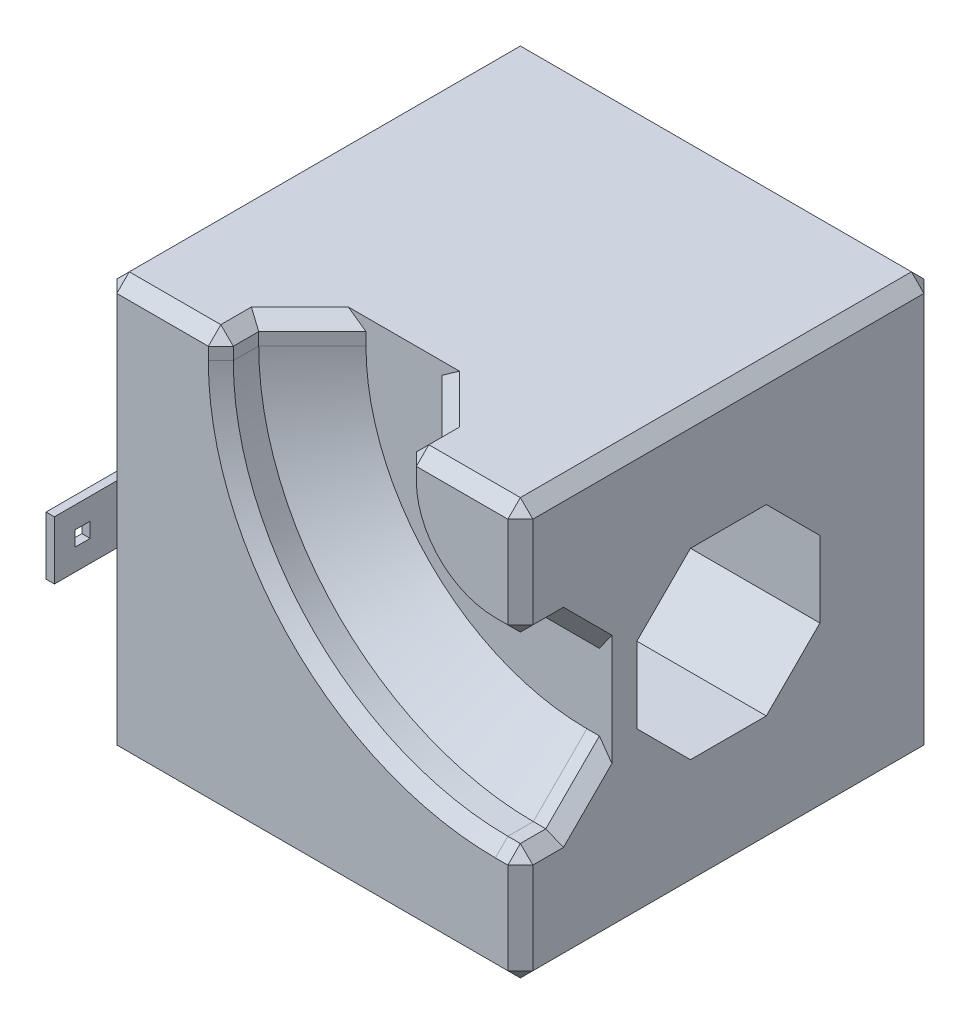
from build123d import *

# Parameters (mm, degrees)
SKETCH1_W                = 50
SKETCH1_H                = 50
BOSS_EXTRUDE1_DEPTH      = 50
CUT_EXTRUDE1_DEPTH       = 87.602540378
CHAMFER1_SIZE            = 1.5
BOSS_EXTRUDE2_DEPTH      = 7
BOSS_EXTRUDE2_DEPTH_BACK = 10
SKETCH5_W                = 1
SKETCH5_H                = 7
SKETCH6_W                = 1.8
SKETCH6_H                = 1.8
CUT_EXTRUDE2_DEPTH       = 7


with BuildPart() as part:
    # Sketch1 → Boss-Extrude1 (new body)
    with BuildSketch(Plane.XY):
        with Locations((25, 25)):
            Rectangle(SKETCH1_W, SKETCH1_H)
    extrude(amount=BOSS_EXTRUDE1_DEPTH)

    # Sketch2 → Cut-Extrude1 (cut, through all)
    with BuildSketch(Plane.ZY):
        Polygon((36, 29.556349186), (29.556349186, 36), (20.443650814, 36), (14, 29.556349186), (14, 20.443650814), (20.443650814, 14), (29.556349186, 14), (36, 20.443650814), align=None)
    extrude(amount=-CUT_EXTRUDE1_DEPTH, mode=Mode.SUBTRACT)

    # Cut-Sweep2: sweep along a path in Sketch4
    with BuildLine(Plane.XY.offset(50)) as cut_sweep2_path:
        Line((25, 50), (25, 47))
        ThreePointArc((25, 47), (31.443650814, 31.443650814), (47, 25))
        Line((47, 25), (50, 25))
    # Sketch3 → Cut-Sweep2 (sweep, cut)
    with BuildSketch(Plane.XZ.offset(-50)):
        Polygon((29.556349186, 39), (36, 45.443650814), (36, 54.556349186), (29.556349186, 61), (20.443650814, 61), (14, 54.556349186), (14, 45.443650814), (20.443650814, 39), align=None)
    sweep(path=cut_sweep2_path.line, mode=Mode.SUBTRACT)

    # Chamfer1
    chamfer1_edges = [part.edges().sort_by_distance(p)[0] for p in [
        (50, 7, 50),
        (43, 50, 50),
        (50, 43, 50),
        (7, 50, 50),
        (14, 48.5, 50),
        (23.665476221, 23.665476221, 50),
        (48.5, 14, 50),
        (36, 48.5, 50),
        (39.221825407, 39.221825407, 50),
        (48.5, 36, 50),
        (36, 50, 47.721825407),
        (14, 50, 47.721825407),
        (50, 36, 47.721825407),
        (50, 14, 47.721825407),
        (50, 17.221825407, 42.221825407),
        (50, 32.778174593, 42.221825407),
        (32.778174593, 50, 42.221825407),
        (17.221825407, 50, 42.221825407),
        (0, 25, 50),
        (25, 50, 0),
        (50, 25, 0),
        (25, 0, 0),
        (0, 25, 0),
        (25, 0, 50),
        (0, 50, 25),
        (50, 50, 25),
        (50, 0, 25),
        (0, 0, 25),
    ]]
    chamfer(chamfer1_edges, length=CHAMFER1_SIZE)

    # Sketch5 → Boss-Extrude2 (add, two sides: drawn at the far end of the back side and taken through both)
    with BuildSketch(Plane.XY.offset(50).offset(-BOSS_EXTRUDE2_DEPTH_BACK)):
        with Locations((0.5, 25)):
            Rectangle(SKETCH5_W, SKETCH5_H)
    extrude(amount=BOSS_EXTRUDE2_DEPTH + BOSS_EXTRUDE2_DEPTH_BACK)

    # Sketch6 → Cut-Extrude2 (cut)
    with BuildSketch(Plane(origin=(1, 0, 0), x_dir=(0, 0, -1), z_dir=(1, 0, 0))):
        with Locations((-53.6, 25)):
            Rectangle(SKETCH6_W, SKETCH6_H)
    extrude(amount=-CUT_EXTRUDE2_DEPTH, mode=Mode.SUBTRACT)


solid = part.part
